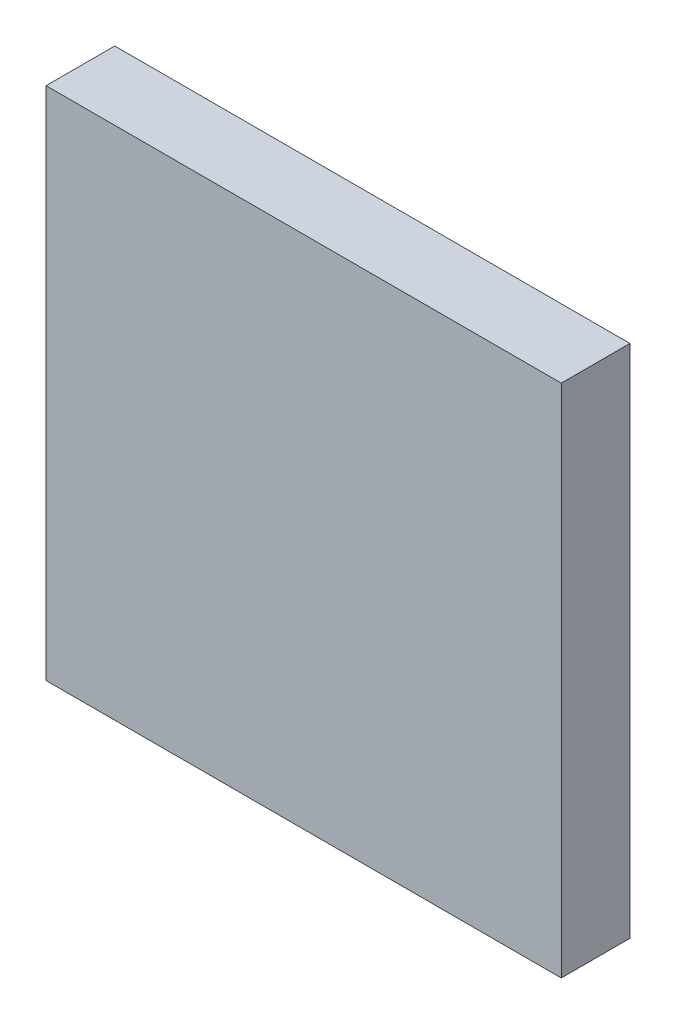
from build123d import *

# Parameters (mm, degrees)
SKETCH_1_W      = 120
SKETCH_1_H      = 120
EXTRUDE_1_DEPTH = 16


with BuildPart() as part:
    # 草图1 → 凸台-拉伸1 (new body)
    with BuildSketch(Plane.XY):
        Rectangle(SKETCH_1_W, SKETCH_1_H)
    extrude(amount=EXTRUDE_1_DEPTH)


solid = part.part
